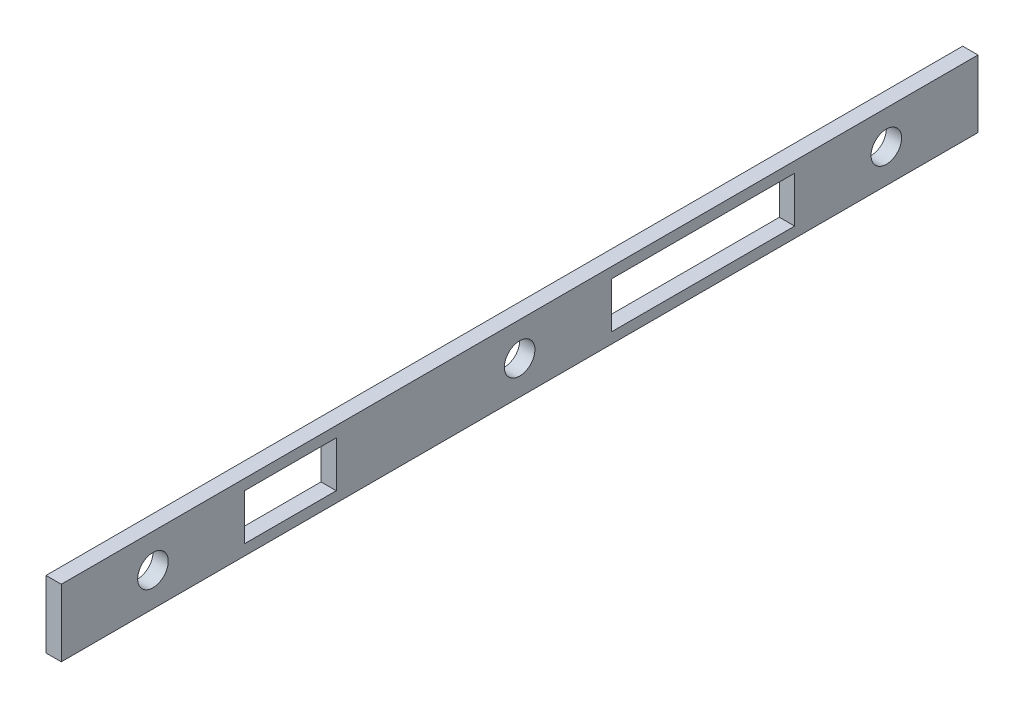
from build123d import *

# Parameters (mm, degrees)
SKETCH1_W           = 300
SKETCH1_H           = 22
BOSS_EXTRUDE1_DEPTH = 5
SKETCH2_R           = 5
SKETCH2_W           = 30
SKETCH2_H           = 15
SKETCH2_W_2         = 60
CUT_EXTRUDE1_DEPTH  = 5


with BuildPart() as part:
    # Sketch1 → Boss-Extrude1 (new body)
    with BuildSketch(Plane(origin=(0, 0, 0), x_dir=(0, 0, -1), z_dir=(1, 0, 0))):
        with Locations((150, 11)):
            Rectangle(SKETCH1_W, SKETCH1_H)
    extrude(amount=BOSS_EXTRUDE1_DEPTH)

    # Sketch2 → Cut-Extrude1 (cut)
    with BuildSketch(Plane(origin=(5, 0, 0), x_dir=(0, 0, -1), z_dir=(1, 0, 0))):
        with Locations((30, 11)):
            Circle(SKETCH2_R)
        with Locations((150, 11)):
            Circle(SKETCH2_R)
        with Locations((270, 11)):
            Circle(SKETCH2_R)
        with Locations((75, 11)):
            Rectangle(SKETCH2_W, SKETCH2_H)
        with Locations((210, 11)):
            Rectangle(SKETCH2_W_2, SKETCH2_H)
    extrude(amount=-CUT_EXTRUDE1_DEPTH, mode=Mode.SUBTRACT)


solid = part.part
